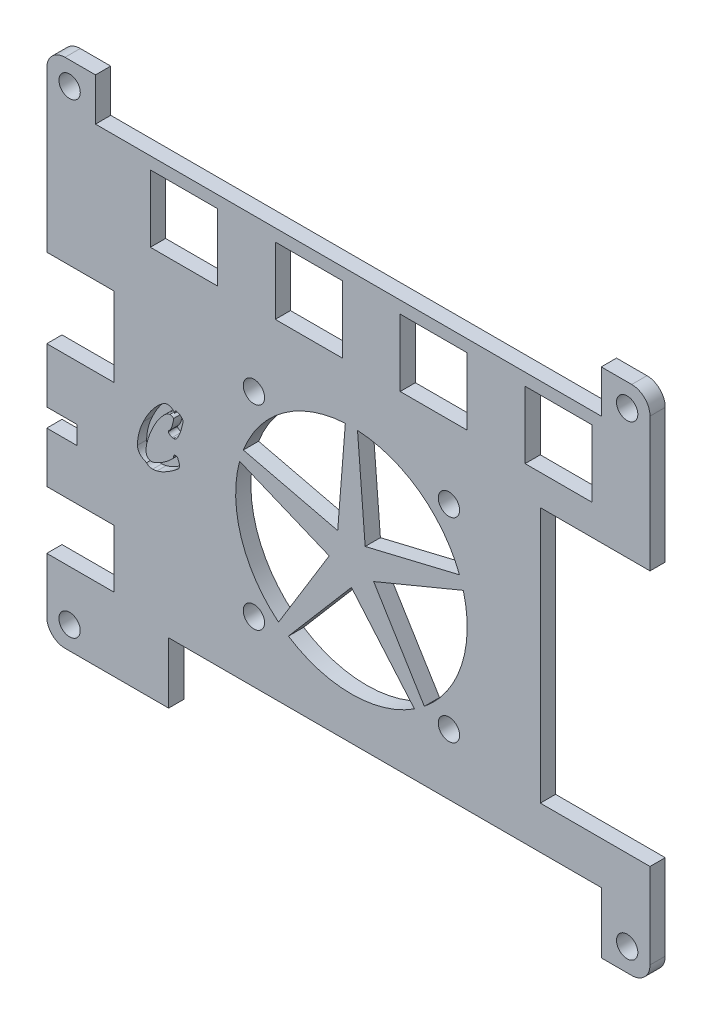
from build123d import *

# Parameters (mm, degrees)
SKETCH_1_R               = 1.75
EXTRUDE_1_DEPTH          = 2.5
SKETCH_2_W               = 11
SKETCH_2_H               = 13
SKETCH_2_H_2             = 9.5
SKETCH_2_W_2             = 5
SKETCH_2_H_3             = 3
SKETCH_2_W_3             = 18
SKETCH_2_H_4             = 42
SKETCH_2_H_5             = 11
SKETCH_2_W_4             = 83
SKETCH_2_H_6             = 7
CUT_EXTRUDE_1_DEPTH      = 3
SKETCH_3_R               = 1.75
CUT_EXTRUDE_2_DEPTH      = 65.965375393
CUT_EXTRUDE_3_DEPTH      = 65.965375393
CUT_EXTRUDE_4_DEPTH      = 65.965375393
CUT_EXTRUDE_4_DEPTH_BACK = 65.965375393
SKETCH_6_W               = 71
SKETCH_6_H               = 10
CUT_EXTRUDE_5_DEPTH      = 1.5


with BuildPart() as part:
    # 草圖1 → 填料-伸長1 (new body)
    with BuildSketch(Plane.XY):
        with BuildLine():
            Line((-46.5, 42), (46.5, 42))
            ThreePointArc((46.5, 42), (48.621320344, 41.121320344), (49.5, 39))
            Line((49.5, 39), (49.5, -39))
            ThreePointArc((49.5, -39), (48.621320344, -41.121320344), (46.5, -42))
            Line((46.5, -42), (-46.5, -42))
            ThreePointArc((-46.5, -42), (-48.621320344, -41.121320344), (-49.5, -39))
            Line((-49.5, -39), (-49.5, 39))
            ThreePointArc((-49.5, 39), (-48.621320344, 41.121320344), (-46.5, 42))
        make_face()
        with Locations((-45.75, 38.25)):
            Circle(SKETCH_1_R, mode=Mode.SUBTRACT)
        with Locations(Location((45.75, 38.25, 0), (0, 0, 180))):
            Circle(SKETCH_1_R, mode=Mode.SUBTRACT)
        with Locations((45.75, -38.25)):
            Circle(SKETCH_1_R, mode=Mode.SUBTRACT)
        with Locations(Location((-45.75, -38.25, 0), (0, 0, 180))):
            Circle(SKETCH_1_R, mode=Mode.SUBTRACT)
    extrude(amount=EXTRUDE_1_DEPTH)

    # 草圖2 → 除料-伸長1 (cut)
    with BuildSketch(Plane.XY.offset(2.5)):
        with Locations((-44, 6.3)):
            Rectangle(SKETCH_2_W, SKETCH_2_H)
        with Locations((-44, -25.25)):
            Rectangle(SKETCH_2_W, SKETCH_2_H_2)
        with Locations((-47, -10.7)):
            Rectangle(SKETCH_2_W_2, SKETCH_2_H_3)
        with Locations((40.5, -4)):
            Rectangle(SKETCH_2_W_3, SKETCH_2_H_4)
        with Locations((34.5, 27.5)):
            Rectangle(SKETCH_2_W, SKETCH_2_H_5)
        with Locations((14, 27.5)):
            Rectangle(SKETCH_2_W, SKETCH_2_H_5)
        with Locations((-6.5, 27.5)):
            Rectangle(SKETCH_2_W, SKETCH_2_H_5)
        with Locations((-27, 27.5)):
            Rectangle(SKETCH_2_W, SKETCH_2_H_5)
        with Locations((0, 38.5)):
            Rectangle(SKETCH_2_W_4, SKETCH_2_H_6)
    extrude(amount=-CUT_EXTRUDE_1_DEPTH, mode=Mode.SUBTRACT)

    # 草圖3 → 除料-伸長2 (cut, through all)
    with BuildSketch(Plane.XY.offset(2.5)):
        with Locations((-15.5, 10)):
            Circle(SKETCH_3_R)
        with Locations((16.5, 10)):
            Circle(SKETCH_3_R)
        with Locations((16.5, -22)):
            Circle(SKETCH_3_R)
        with Locations((-15.5, -22)):
            Circle(SKETCH_3_R)
    extrude(amount=-CUT_EXTRUDE_2_DEPTH, mode=Mode.SUBTRACT)

    # 草圖4 → 除料-伸長3 (cut, through all)
    with BuildSketch(Plane.XY.offset(2.5)):
        with BuildLine():
            Line((-0.5, 12.973665961), (-1.754664245, -2.896720896))
            Line((-1.754664245, -2.896720896), (-17.236011656, 0.814241744))
            ThreePointArc((-17.236011656, 0.814241744), (-10.667919794, 9.371322893), (-0.5, 12.973665961))
        make_face()
        with BuildLine():
            Line((1.5, 12.973665961), (2.754664245, -2.896720896))
            Line((2.754664245, -2.896720896), (18.236011656, 0.814241744))
            ThreePointArc((18.236011656, 0.814241744), (11.667919794, 9.371322893), (1.5, 12.973665961))
        make_face()
        with BuildLine():
            Line((18.854045645, -1.087871289), (4.148123382, -7.185347141))
            Line((4.148123382, -7.185347141), (12.461458028, -20.762232956))
            ThreePointArc((12.461458028, -20.762232956), (18.57007381, -11.871322893), (18.854045645, -1.087871289))
        make_face()
        with BuildLine():
            Line((10.843424039, -21.93780346), (0.5, -9.835863926))
            Line((0.5, -9.835863926), (-9.843424039, -21.93780346))
            ThreePointArc((-9.843424039, -21.93780346), (0.5, -25), (10.843424039, -21.93780346))
        make_face()
        with BuildLine():
            Line((-11.461458028, -20.762232956), (-3.148123382, -7.185347141))
            Line((-3.148123382, -7.185347141), (-17.854045645, -1.087871289))
            ThreePointArc((-17.854045645, -1.087871289), (-17.57007381, -11.871322893), (-11.461458028, -20.762232956))
        make_face()
    extrude(amount=-CUT_EXTRUDE_3_DEPTH, mode=Mode.SUBTRACT)

    # 草圖6 → 除料-伸長4 (cut, two sides: drawn at the far end of the back side and taken through both)
    with BuildSketch(Plane.XY.offset(2.5).offset(-CUT_EXTRUDE_4_DEPTH_BACK)):
        with Locations((6, -37)):
            Rectangle(SKETCH_6_W, SKETCH_6_H)
    extrude(amount=CUT_EXTRUDE_4_DEPTH + CUT_EXTRUDE_4_DEPTH_BACK, mode=Mode.SUBTRACT)

    # 草圖7 → 除料-伸長5 (cut)
    with BuildSketch(Plane.XY.offset(2.5)):
        with BuildLine():
            add(Edge.make_bspline(
                [(-27.213907129, -0.546189864), (-27.240966819, -0.661891563), (-27.293914372, -0.888284457), (-27.386663764, -1.216875878), (-27.476678761, -1.530092011), (-27.577158329, -1.823882439), (-27.680326262, -2.100074681), (-27.788540226, -2.3584032), (-27.900181982, -2.599655391), (-27.9817749, -2.751563394), (-28.021478396, -2.825482539)],
                knots=[0, 0, 0, 0, 1.17548011, 2.300055629, 3.377643735, 4.399384343, 5.371186053, 6.294248961, 7.169973561, 8, 8, 8, 8], degree=3))
            add(Edge.make_bspline(
                [(-28.021478396, -2.825482539), (-28.061858407, -2.892448829), (-28.137568582, -3.018006736), (-28.291783603, -3.164197222), (-28.472267722, -3.252195348), (-28.600867245, -3.263353418), (-28.665770226, -3.268984792)],
                knots=[0, 0, 0, 0, 1.136345707, 2.130582215, 3.056522249, 4, 4, 4, 4], degree=3))
            add(Edge.make_bspline(
                [(-28.665770226, -3.268984792), (-28.701973947, -3.266308215), (-28.781150486, -3.260454614), (-28.857965746, -3.240239734), (-28.899656987, -3.229268172)],
                knots=[0, 0, 0, 0, 0.914506271, 2, 2, 2, 2], degree=3))
            add(Edge.make_bspline(
                [(-28.899656987, -3.229268172), (-28.949303434, -3.214101231), (-29.043414132, -3.185350505), (-29.17095713, -3.129203979), (-29.280514952, -3.072732654), (-29.371017893, -3.011243683), (-29.440007145, -2.942550824), (-29.490782582, -2.869720844), (-29.524180623, -2.792189062), (-29.52708181, -2.737529974), (-29.528503465, -2.710745637)],
                knots=[0, 0, 0, 0, 1.429813108, 2.710379391, 3.835071875, 4.825044465, 5.713931837, 6.501287065, 7.265592739, 8, 8, 8, 8], degree=3))
            add(Edge.make_bspline(
                [(-29.528503465, -2.710745637), (-29.526221279, -2.677214217), (-29.521937726, -2.614277362), (-29.483115249, -2.529765762), (-29.416581398, -2.467305551), (-29.359737403, -2.4489677), (-29.329920367, -2.439348736)],
                knots=[0, 0, 0, 0, 1.096743216, 2.058533962, 2.981620438, 4, 4, 4, 4], degree=3))
            add(Edge.make_bspline(
                [(-29.329920367, -2.439348736), (-29.2863352, -2.368541641), (-29.198077956, -2.22516169), (-29.082103165, -1.998868668), (-28.980473631, -1.761220425), (-28.891784025, -1.514632999), (-28.819720395, -1.256097363), (-28.757320657, -0.988451867), (-28.711048922, -0.709025184), (-28.69126464, -0.519097375), (-28.681215578, -0.422627047)],
                knots=[0, 0, 0, 0, 0.932470262, 1.888194122, 2.849138905, 3.830377582, 4.825428712, 5.858178979, 6.912101515, 8, 8, 8, 8], degree=3))
            add(Edge.make_bspline(
                [(-28.681215578, -0.422627047), (-28.732325296, -0.382715528), (-28.829417442, -0.306896384), (-28.986418884, -0.223751716), (-29.142716865, -0.17137415), (-29.247913409, -0.165242151), (-29.299029663, -0.16226254)],
                knots=[0, 0, 0, 0, 1.1358774, 2.15780442, 3.104855215, 4, 4, 4, 4], degree=3))
            add(Edge.make_bspline(
                [(-29.299029663, -0.16226254), (-29.350286355, -0.166521792), (-29.459567236, -0.175602651), (-29.625855934, -0.242642536), (-29.804496697, -0.342383892), (-29.994435513, -0.4847768), (-30.19724117, -0.664778208), (-30.412930747, -0.884576087), (-30.642481175, -1.143221209), (-30.794434941, -1.333166795), (-30.874455577, -1.43319437)],
                knots=[0, 0, 0, 0, 0.592092738, 1.262360351, 2.050807857, 2.957922259, 4.000922916, 5.186238967, 6.51824041, 8, 8, 8, 8], degree=3))
            add(Edge.make_bspline(
                [(-30.874455577, -1.43319437), (-30.949621234, -1.532584593), (-31.102074345, -1.734170652), (-31.317518735, -2.052881468), (-31.527911549, -2.389286446), (-31.731335565, -2.744285952), (-31.934474802, -3.114681671), (-32.123790249, -3.506058376), (-32.313397343, -3.912722096), (-32.431628411, -4.192377572), (-32.491804591, -4.334714087)],
                knots=[0, 0, 0, 0, 0.897597506, 1.820532636, 2.770288519, 3.755462829, 4.767833523, 5.812859352, 6.88680893, 8, 8, 8, 8], degree=3))
            add(Edge.make_bspline(
                [(-32.491804591, -4.334714087), (-32.548054203, -4.474043961), (-32.657781509, -4.745837683), (-32.800197049, -5.150524148), (-32.924947592, -5.536861646), (-33.024635675, -5.907328319), (-33.103022389, -6.260633792), (-33.157072644, -6.598166419), (-33.196052167, -6.91833469), (-33.200254757, -7.126539046), (-33.202290787, -7.227407888)],
                knots=[0, 0, 0, 0, 1.203426402, 2.347549256, 3.435664649, 4.454628101, 5.419547923, 6.332891945, 7.192335538, 8, 8, 8, 8], degree=3))
            add(Edge.make_bspline(
                [(-33.202290787, -7.227407888), (-33.19834566, -7.329355518), (-33.191032363, -7.518341397), (-33.131682246, -7.775990423), (-33.038634428, -7.991248063), (-32.935764734, -8.092608587), (-32.886764309, -8.140890141)],
                knots=[0, 0, 0, 0, 1.226523956, 2.273674328, 3.177690837, 4, 4, 4, 4], degree=3))
            add(Edge.make_bspline(
                [(-32.886764309, -8.140890141), (-32.844237878, -8.17311574), (-32.76336768, -8.234397407), (-32.633273794, -8.301833623), (-32.504727374, -8.344233623), (-32.418538888, -8.349957813), (-32.377067689, -8.352712113)],
                knots=[0, 0, 0, 0, 1.137057887, 2.16228109, 3.115747252, 4, 4, 4, 4], degree=3))
            add(Edge.make_bspline(
                [(-32.377067689, -8.352712113), (-32.304572193, -8.348563951), (-32.146317849, -8.339508702), (-31.994027549, -8.29512445), (-31.911500647, -8.271072395)],
                knots=[0, 0, 0, 0, 0.916189657, 2, 2, 2, 2], degree=3))
            add(Edge.make_bspline(
                [(-31.911500647, -8.271072395), (-31.791530795, -8.228981376), (-31.537351493, -8.139803423), (-31.151750834, -7.954834521), (-30.737831475, -7.722214105), (-30.459995393, -7.539596778), (-30.314009944, -7.443642818)],
                knots=[0, 0, 0, 0, 0.844837648, 1.789951725, 2.838758136, 4, 4, 4, 4], degree=3))
            add(Edge.make_bspline(
                [(-30.314009944, -7.443642818), (-30.174670068, -7.346537144), (-29.902989304, -7.157203377), (-29.524218959, -6.856715835), (-29.179619849, -6.554529481), (-28.970607809, -6.343793401), (-28.868766283, -6.241111833)],
                knots=[0, 0, 0, 0, 1.081871392, 2.109400803, 3.078801825, 4, 4, 4, 4], degree=3))
            add(Edge.make_bspline(
                [(-28.868766283, -6.241111833), (-28.843845736, -6.212629938), (-28.793683805, -6.155299461), (-28.742871397, -6.05051944), (-28.700622659, -5.937924627), (-28.689251321, -5.856831829), (-28.683422057, -5.81526141)],
                knots=[0, 0, 0, 0, 0.957124976, 1.926572402, 2.937103467, 4, 4, 4, 4], degree=3))
            add(Edge.make_bspline(
                [(-28.683422057, -5.81526141), (-28.675203279, -5.772416716), (-28.660139069, -5.693886614), (-28.598653082, -5.595838455), (-28.504664464, -5.535707032), (-28.432794035, -5.530957941), (-28.394373325, -5.528419157)],
                knots=[0, 0, 0, 0, 1.152307318, 2.112065746, 2.99074242, 4, 4, 4, 4], degree=3))
            add(Edge.make_bspline(
                [(-28.394373325, -5.528419157), (-28.343968822, -5.530225224), (-28.251296037, -5.533545826), (-28.126383318, -5.575448406), (-28.029207595, -5.649098172), (-27.996185651, -5.718518745), (-27.979555297, -5.753480002)],
                knots=[0, 0, 0, 0, 1.193923481, 2.195125591, 3.091037791, 4, 4, 4, 4], degree=3))
            add(Edge.make_bspline(
                [(-27.979555297, -5.753480002), (-27.957511672, -5.810117242), (-27.915205578, -5.918815353), (-27.854513342, -6.073828679), (-27.807451639, -6.216101351), (-27.763431366, -6.341503003), (-27.732846275, -6.454534071), (-27.710740067, -6.553156414), (-27.695934787, -6.637840826), (-27.693719879, -6.689716891), (-27.692713044, -6.713298311)],
                knots=[0, 0, 0, 0, 1.450183324, 2.783189792, 3.970808662, 5.025190584, 5.953281632, 6.762235615, 7.437346652, 8, 8, 8, 8], degree=3))
            add(Edge.make_bspline(
                [(-27.692713044, -6.713298311), (-27.696391347, -6.757192113), (-27.704119343, -6.849411571), (-27.763339297, -6.986660297), (-27.852272708, -7.128983578), (-27.932359526, -7.217586087), (-27.975142339, -7.264918029)],
                knots=[0, 0, 0, 0, 0.829478767, 1.742708054, 2.794142363, 4, 4, 4, 4], degree=3))
            add(Edge.make_bspline(
                [(-27.975142339, -7.264918029), (-27.986015089, -7.275398319), (-28.011950579, -7.300397648), (-28.061380873, -7.338114448), (-28.120192981, -7.390796181), (-28.195845983, -7.44969372), (-28.286576869, -7.51749862), (-28.390182108, -7.597075864), (-28.506495419, -7.687621583), (-28.58920902, -7.750434091), (-28.632673043, -7.783440564)],
                knots=[0, 0, 0, 0, 0.432371423, 1.03136424, 1.77876968, 2.693665433, 3.776799812, 5.024355513, 6.436369844, 8, 8, 8, 8], degree=3))
            add(Edge.make_bspline(
                [(-28.632673043, -7.783440564), (-28.759922109, -7.876414502), (-29.00841233, -8.057972727), (-29.383440061, -8.305784016), (-29.745901799, -8.530603546), (-30.099040663, -8.727822917), (-30.443164811, -8.896527244), (-30.77434929, -9.044774568), (-31.096669383, -9.162674665), (-31.310923215, -9.221945508), (-31.415042901, -9.250749014)],
                knots=[0, 0, 0, 0, 1.195167025, 2.333905692, 3.408357458, 4.429710794, 5.40019365, 6.314387284, 7.180852614, 8, 8, 8, 8], degree=3))
            add(Edge.make_bspline(
                [(-31.415042901, -9.250749014), (-31.531489639, -9.277411764), (-31.761739466, -9.330131949), (-31.997814468, -9.337548801), (-32.114496703, -9.341214648)],
                knots=[0, 0, 0, 0, 1.011481652, 2, 2, 2, 2], degree=3))
            add(Edge.make_bspline(
                [(-32.114496703, -9.341214648), (-32.168985939, -9.340030518), (-32.274671028, -9.337733829), (-32.428398717, -9.317474516), (-32.570860933, -9.284593476), (-32.70415546, -9.240824132), (-32.824475665, -9.181094975), (-32.935496422, -9.109340111), (-33.034617552, -9.023482814), (-33.091986731, -8.957272117), (-33.120651069, -8.924190141)],
                knots=[0, 0, 0, 0, 1.158427828, 2.24683917, 3.290262808, 4.264696939, 5.223055, 6.138455096, 7.069884688, 8, 8, 8, 8], degree=3))
            add(Edge.make_bspline(
                [(-33.120651069, -8.924190141), (-33.237810314, -8.877095953), (-33.462192463, -8.78690166), (-33.769699919, -8.622699717), (-34.027922554, -8.43372031), (-34.242928014, -8.227303228), (-34.40869681, -7.996904242), (-34.527689888, -7.746789383), (-34.59824232, -7.475393312), (-34.607488911, -7.28813488), (-34.612230787, -7.192104226)],
                knots=[0, 0, 0, 0, 1.236253954, 2.367660526, 3.403586428, 4.361244228, 5.274838688, 6.167403065, 7.060199957, 8, 8, 8, 8], degree=3))
            add(Edge.make_bspline(
                [(-34.612230787, -7.192104226), (-34.608995736, -7.041967705), (-34.602464715, -6.738867373), (-34.557089318, -6.281073269), (-34.480761619, -5.815781038), (-34.377061931, -5.342154703), (-34.244635533, -4.860173598), (-34.080012687, -4.371529451), (-33.88592071, -3.874651569), (-33.737009137, -3.544893306), (-33.661238393, -3.377102257)],
                knots=[0, 0, 0, 0, 0.90924978, 1.835622051, 2.783245055, 3.763575929, 4.770762496, 5.808925144, 6.885114366, 8, 8, 8, 8], degree=3))
            add(Edge.make_bspline(
                [(-33.661238393, -3.377102257), (-33.59240946, -3.232429467), (-33.455304407, -2.944245851), (-33.232605571, -2.524168227), (-32.997381875, -2.117203265), (-32.75407958, -1.721860518), (-32.494285019, -1.341502708), (-32.223269435, -0.973681101), (-31.941403944, -0.617511545), (-31.743246804, -0.390237027), (-31.644516704, -0.276999441)],
                knots=[0, 0, 0, 0, 1.035836397, 2.063353304, 3.073219881, 4.074878676, 5.0641667, 6.05053557, 7.028696021, 8, 8, 8, 8], degree=3))
            add(Edge.make_bspline(
                [(-31.644516704, -0.276999441), (-31.548846651, -0.174128434), (-31.366045907, 0.022431471), (-31.093761377, 0.293763096), (-30.830124121, 0.521613395), (-30.58078708, 0.712271958), (-30.345557339, 0.868444833), (-30.119241186, 0.977883944), (-29.907711577, 1.057655719), (-29.767368292, 1.075777654), (-29.700608817, 1.084398023)],
                knots=[0, 0, 0, 0, 1.392821018, 2.661320967, 3.808996163, 4.84450809, 5.77293453, 6.601292718, 7.334653137, 8, 8, 8, 8], degree=3))
            add(Edge.make_bspline(
                [(-29.700608817, 1.084398023), (-29.637912213, 1.085202255), (-29.510571813, 1.086835696), (-29.318972559, 1.046218166), (-29.126170855, 0.975060744), (-29.004624161, 0.904672305), (-28.941580085, 0.868163093)],
                knots=[0, 0, 0, 0, 0.936042291, 1.901155577, 2.911367301, 4, 4, 4, 4], degree=3))
            add(Edge.make_bspline(
                [(-28.941580085, 0.868163093), (-28.916756722, 0.849661726), (-28.854321658, 0.803127579), (-28.761505435, 0.698930276), (-28.64371344, 0.557086113), (-28.561479716, 0.446479369), (-28.515729663, 0.38494422)],
                knots=[0, 0, 0, 0, 0.573609307, 1.442726923, 2.57728224, 4, 4, 4, 4], degree=3))
            add(Edge.make_bspline(
                [(-28.515729663, 0.38494422), (-28.513519858, 0.419580134), (-28.50935307, 0.484889266), (-28.49252181, 0.57565773), (-28.465544944, 0.651841056), (-28.433028645, 0.715709846), (-28.390101823, 0.765865016), (-28.338711558, 0.80219119), (-28.278176787, 0.822946987), (-28.235668043, 0.825109375), (-28.213442058, 0.826239995)],
                knots=[0, 0, 0, 0, 1.389836692, 2.62066218, 3.683019076, 4.618951188, 5.4754507, 6.300982094, 7.111656954, 8, 8, 8, 8], degree=3))
            add(Edge.make_bspline(
                [(-28.213442058, 0.826239995), (-28.159146718, 0.821511726), (-28.041628971, 0.811277782), (-27.863663133, 0.734313471), (-27.66980986, 0.621010198), (-27.544273384, 0.519303559), (-27.476478114, 0.46437746)],
                knots=[0, 0, 0, 0, 0.778197106, 1.684342942, 2.749442408, 4, 4, 4, 4], degree=3))
            add(Edge.make_bspline(
                [(-27.476478114, 0.46437746), (-27.424534278, 0.417714716), (-27.329793203, 0.332605901), (-27.217193903, 0.20136331), (-27.144300547, 0.076766608), (-27.13299968, -0.007124132), (-27.127854453, -0.04531916)],
                knots=[0, 0, 0, 0, 1.320969295, 2.409333959, 3.275777843, 4, 4, 4, 4], degree=3))
            add(Edge.make_bspline(
                [(-27.127854453, -0.04531916), (-27.128813828, -0.070380287), (-27.131199527, -0.132700365), (-27.15220746, -0.241149574), (-27.177483711, -0.383402029), (-27.200925647, -0.488171497), (-27.213907129, -0.546189864)],
                knots=[0, 0, 0, 0, 0.5907381, 1.469001931, 2.598404876, 4, 4, 4, 4], degree=3))
        make_face()
    extrude(amount=-CUT_EXTRUDE_5_DEPTH, mode=Mode.SUBTRACT)


solid = part.part
